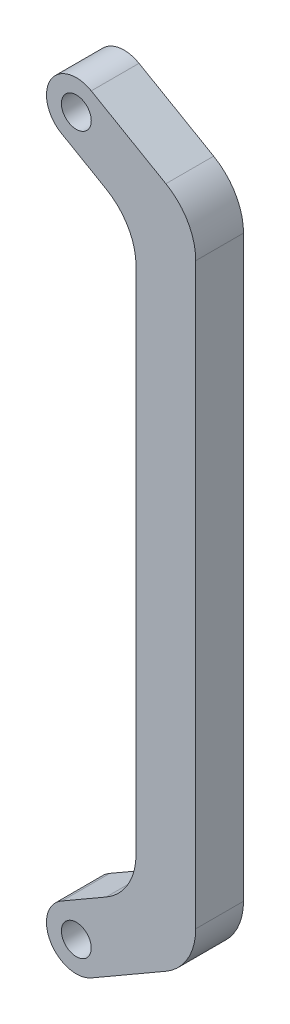
from build123d import *

# Parameters (mm, degrees)
SKETCH_1_R          = 5
EXTRUDE_1_DEPTH     = 8
SKETCH_1_R_2        = 5.001260551
EXTRUDE_1_2_DEPTH   = 8
EXTRUDE_4_DEPTH     = 8
SKETCH_5_R          = 2.5
CUT_EXTRUDE_2_DEPTH = 127.842421926
FILLET_1_R          = 10


with BuildPart() as part:
    # 草图1 → 凸台-拉伸1 (new body)
    with BuildSketch(Plane.XY):
        with Locations((0, 120)):
            Circle(SKETCH_1_R)
    extrude(amount=EXTRUDE_1_DEPTH)



with BuildPart() as body_2:
    # 草图1 → Extrude 1 2 (new body)
    with BuildSketch(Plane.XY):
        Circle(SKETCH_1_R_2)
    extrude(amount=EXTRUDE_1_2_DEPTH)


with BuildPart() as part_1:
    add(part.part)

    add(body_2.part)  # 拉伸-薄壁4 merges body 2
    # 草图4 → 拉伸-薄壁4 (add)
    with BuildSketch(Plane.XY):
        Polygon((-2.5, 115.669872981), (10, 108.452994616), (10, 11.547005384), (-2.5, 4.330127019), (2.5, -4.330127019), (20, 5.773502692), (20, 114.226497308), (2.5, 124.330127019), align=None)
    extrude(amount=EXTRUDE_4_DEPTH)

    # 草图5 → 切除-拉伸2 (cut, through all)
    with BuildSketch(Plane.XY.offset(8)):
        with Locations((0, 120)):
            Circle(SKETCH_5_R)
        Circle(SKETCH_5_R)
    extrude(amount=-CUT_EXTRUDE_2_DEPTH, mode=Mode.SUBTRACT)

    # 圆角1
    fillet_1_edges = [part_1.edges().sort_by_distance(p)[0] for p in [
        (10, 11.547005384, 4),
        (20, 5.773502692, 4),
        (20, 114.226497308, 4),
        (10, 108.452994616, 4),
    ]]
    fillet(fillet_1_edges, radius=FILLET_1_R)


solid = part_1.part
